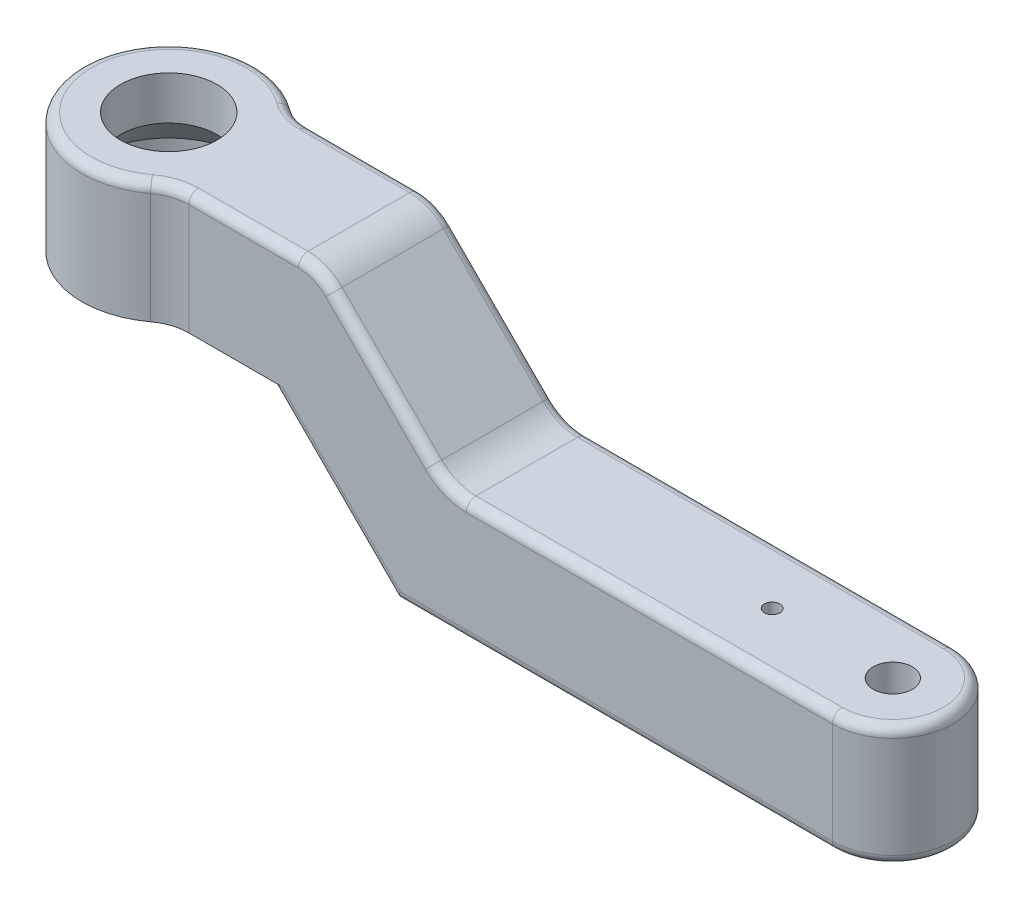
from build123d import *

# Parameters (mm, degrees)
SALIENTE_EXTRUIR1_DEPTH = 51.5
CORTAR_EXTRUIR2_DEPTH   = 25.75
CROQUIS5_R              = 4.05
CROQUIS5_R_2            = 1.6
CORTAR_EXTRUIR3_DEPTH   = 108.820452605
REDONDEO1_R             = 10
REDONDEO2_R             = 2
REDONDEO3_R             = 2


with BuildPart() as part:
    # Croquis1 → Saliente-Extruir1 (new body)
    with BuildSketch(Plane(origin=(0, 0, 0), x_dir=(1, 0, 0), z_dir=(0, 1, 0))):
        with BuildLine():
            Line((75, -12.5), (-58.334166688, -12.5))
            ThreePointArc((-58.334166688, -12.5), (-61.46808254, -13.003760143), (-64.286250013, -14.464285714))
            ThreePointArc((-64.286250013, -14.464285714), (-93, 0), (-64.286250013, 14.464285714))
            ThreePointArc((-64.286250013, 14.464285714), (-61.46808254, 13.003760143), (-58.334166688, 12.5))
            Line((-58.334166688, 12.5), (75, 12.5))
            ThreePointArc((75, 12.5), (87.5, 0), (75, -12.5))
        make_face()
    extrude(amount=SALIENTE_EXTRUIR1_DEPTH)

    # Croquis3 → Cortar-Extruir2 (cut, symmetric)
    with BuildSketch(Plane.XY):
        Polygon((87.5, 25), (-5, 25), (-31.5, 51.5), (87.5, 51.5), align=None)
        Polygon((-15.355339059, 0), (-41.855339059, 26.5), (-93, 26.5), (-93, 0), align=None)
    extrude(amount=CORTAR_EXTRUIR2_DEPTH, both=True, mode=Mode.SUBTRACT)

    # Croquis4 → Cortar-Revolución1 (revolve, cut)
    with BuildSketch(Plane.XY):
        Polygon((-75, 26.5), (-75, 51.5), (-85, 51.5), (-85, 42.5), (-91.1, 35.5), (-91.1, 26.5), align=None)
    revolve(axis=Axis((-75, 26.5, 0), (0, 1, 0)), mode=Mode.SUBTRACT)

    # Croquis5 → Cortar-Extruir3 (cut, through all)
    with BuildSketch(Plane(origin=(0, 0, 0), x_dir=(1, 0, 0), z_dir=(0, 1, 0))):
        with Locations((75, 0)):
            Circle(CROQUIS5_R)
        with Locations((50, 0)):
            Circle(CROQUIS5_R_2)
    extrude(amount=CORTAR_EXTRUIR3_DEPTH, mode=Mode.SUBTRACT)

    # Redondeo1
    redondeo1_edges = [part.edges().sort_by_distance(p)[0] for p in [
        (-31.5, 51.5, 0),
        (-5, 25, 0),
    ]]
    fillet(redondeo1_edges, radius=REDONDEO1_R)

    # Redondeo2
    redondeo2_edges = [part.edges().sort_by_distance(p)[0] for p in [
        (-4.6846987, 25.761204675, -12.5),
        (-18.25, 38.25, -12.5),
        (-31.8153013, 50.738795325, -12.5),
        (-46.988151156, 51.5, -12.5),
        (-61.46808254, 51.5, -13.003760143),
        (-93, 51.5, 0),
        (-61.46808254, 51.5, 13.003760143),
        (-46.988151156, 51.5, 12.5),
        (-31.8153013, 50.738795325, 12.5),
        (-18.25, 38.25, 12.5),
        (-4.6846987, 25.761204675, 12.5),
        (37.071067812, 25, 12.5),
        (87.5, 25, 0),
        (37.071067812, 25, -12.5),
    ]]
    fillet(redondeo2_edges, radius=REDONDEO2_R)

    # Redondeo3
    redondeo3_edges = [part.edges().sort_by_distance(p)[0] for p in [
        (29.82233047, 0, 12.5),
        (87.5, 0, 0),
        (-28.605339059, 13.25, 12.5),
        (-28.605339059, 13.25, -12.5),
        (29.82233047, 0, -12.5),
    ]]
    fillet(redondeo3_edges, radius=REDONDEO3_R)


solid = part.part
